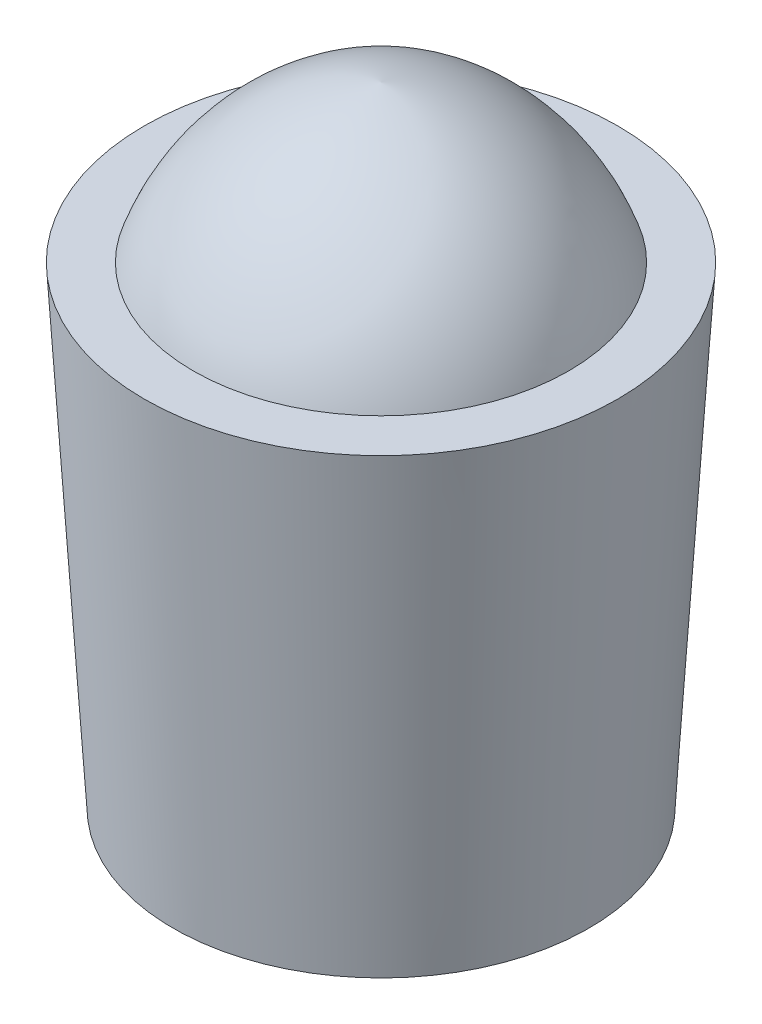
from build123d import *


with BuildPart() as part:
    # Sketch1 → Revolve1 (revolve)
    with BuildSketch(Plane.XY):
        with BuildLine():
            Line((0, 0), (0, 19.211688466))
            ThreePointArc((0, 19.211688466), (3.543711526, 17.639077691), (5.739120867, 14.44358495))
            Line((5.739120867, 14.44358495), (7.231897946, 14.44358495))
            Line((7.231897946, 14.44358495), (6.35, 0))
            Line((6.35, 0), (0, 0))
        make_face()
    revolve(axis=Axis((0, 0, 0), (0, 1, 0)))


solid = part.part
